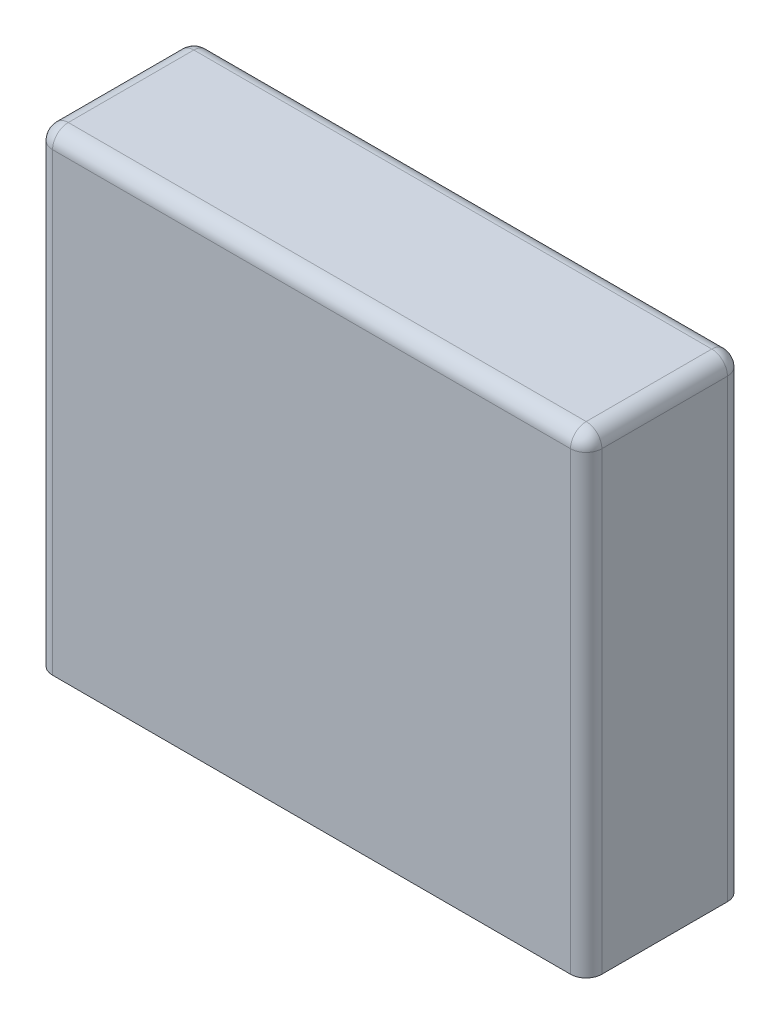
from build123d import *

# Parameters (mm, degrees)
SKETCH_1_W      = 7
SKETCH_1_H      = 6
EXTRUDE_1_DEPTH = 2
FILLET_1_R      = 0.2


with BuildPart() as part:
    # 草圖1 → 伸長1 (new body)
    with BuildSketch(Plane.XY):
        Rectangle(SKETCH_1_W, SKETCH_1_H)
    extrude(amount=EXTRUDE_1_DEPTH)

    # 圓角1
    fillet_1_edges = [part.edges().sort_by_distance(p)[0] for p in [
        (-3.5, 0, 2),
        (3.5, 0, 2),
        (-3.5, 0, 0),
        (0, 3, 0),
        (3.5, 0, 0),
        (0, 3, 2),
        (-3.5, 3, 1),
        (3.5, 3, 1),
    ]]
    fillet(fillet_1_edges, radius=FILLET_1_R)


solid = part.part
